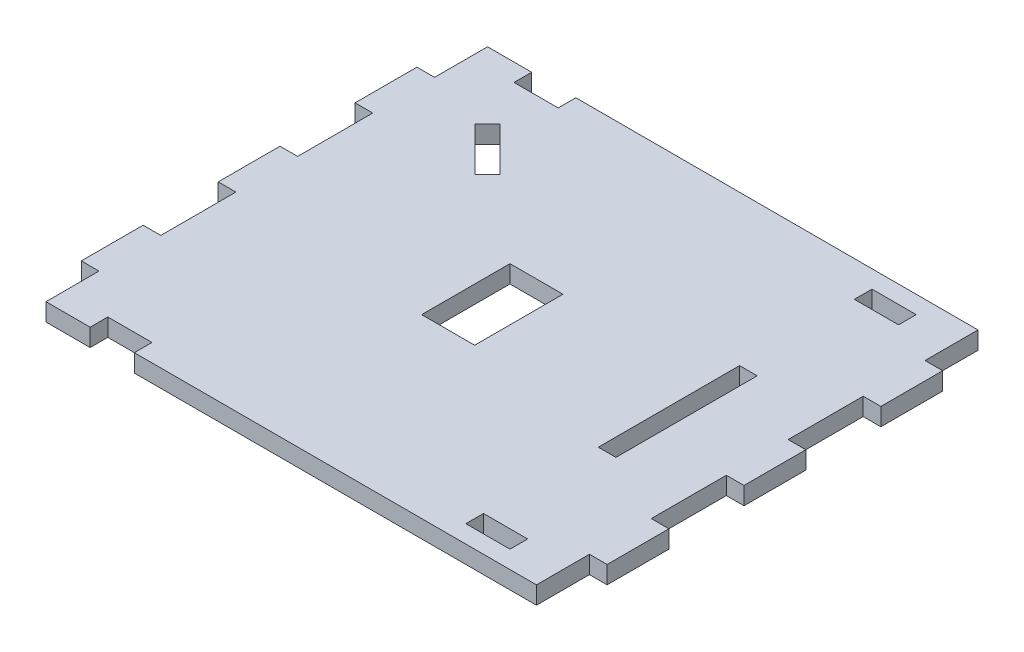
from build123d import *

# Parameters (mm, degrees)
SKETCH1_W           = 55.54
SKETCH1_H           = 50
SKETCH1_W_2         = 2
SKETCH1_H_2         = 16
SKETCH1_H_3         = 7
BOSS_EXTRUDE1_DEPTH = 2
SKETCH3_W           = 5
SKETCH3_H           = 2
CUT_EXTRUDE1_DEPTH  = 2
SKETCH4_W           = 6
SKETCH4_H           = 10
CUT_EXTRUDE2_DEPTH  = 2
CUT_EXTRUDE3_DEPTH  = 2


with BuildPart() as part:
    # Sketch1 → Boss-Extrude1 (new body)
    # profile 1 of 7: a face of its own
    with BuildSketch(Plane(origin=(0, 0, 0), x_dir=(1, 0, 0), z_dir=(0, 1, 0))):
        Rectangle(SKETCH1_W, SKETCH1_H)
        with Locations((18.77, 0)):
            Rectangle(SKETCH1_W_2, SKETCH1_H_2, mode=Mode.SUBTRACT)
    # profile 2 of 7: a face of its own
    with BuildSketch(Plane(origin=(0, 0, 0), x_dir=(1, 0, 0), z_dir=(0, 1, 0))):
        with Locations((28.77, 0)):
            Rectangle(SKETCH1_W_2, SKETCH1_H_3)
    # profile 3 of 7: a face of its own
    with BuildSketch(Plane(origin=(0, 0, 0), x_dir=(1, 0, 0), z_dir=(0, 1, 0))):
        with Locations((28.77, 15.5)):
            Rectangle(SKETCH1_W_2, SKETCH1_H_3)
    # profile 4 of 7: a face of its own
    with BuildSketch(Plane(origin=(0, 0, 0), x_dir=(1, 0, 0), z_dir=(0, 1, 0))):
        with Locations((28.77, -15.5)):
            Rectangle(SKETCH1_W_2, SKETCH1_H_3)
    # profile 5 of 7: a face of its own
    with BuildSketch(Plane(origin=(0, 0, 0), x_dir=(1, 0, 0), z_dir=(0, 1, 0))):
        with Locations((-28.77, 0)):
            Rectangle(SKETCH1_W_2, SKETCH1_H_3)
    # profile 6 of 7: a face of its own
    with BuildSketch(Plane(origin=(0, 0, 0), x_dir=(1, 0, 0), z_dir=(0, 1, 0))):
        with Locations((-28.77, -15.5)):
            Rectangle(SKETCH1_W_2, SKETCH1_H_3)
    # profile 7 of 7: a face of its own
    with BuildSketch(Plane(origin=(0, 0, 0), x_dir=(1, 0, 0), z_dir=(0, 1, 0))):
        with Locations((-28.77, 15.5)):
            Rectangle(SKETCH1_W_2, SKETCH1_H_3)
    extrude(amount=BOSS_EXTRUDE1_DEPTH)

    # Sketch3 → Cut-Extrude1 (cut)
    with BuildSketch(Plane(origin=(0, 2, 0), x_dir=(1, 0, 0), z_dir=(0, 1, 0))):
        with Locations((20.27, -22)):
            Rectangle(SKETCH3_W, SKETCH3_H)
        with Locations((20.27, 22)):
            Rectangle(SKETCH3_W, SKETCH3_H)
        with Locations((-20.27, 24)):
            Rectangle(SKETCH3_W, SKETCH3_H)
        with Locations((-20.27, -24)):
            Rectangle(SKETCH3_W, SKETCH3_H)
    extrude(amount=-CUT_EXTRUDE1_DEPTH, mode=Mode.SUBTRACT)

    # Sketch4 → Cut-Extrude2 (cut)
    with BuildSketch(Plane(origin=(0, 2, 0), x_dir=(1, 0, 0), z_dir=(0, 1, 0))):
        with Locations((-2.23, 0)):
            Rectangle(SKETCH4_W, SKETCH4_H)
    extrude(amount=-CUT_EXTRUDE2_DEPTH, mode=Mode.SUBTRACT)

    # Sketch5 → Cut-Extrude3 (cut)
    with BuildSketch(Plane(origin=(0, 2, 0), x_dir=(1, 0, 0), z_dir=(0, 1, 0))):
        Polygon((-19.496864222, 18.141064222), (-14.547116754, 13.191316754), (-15.961330317, 11.777103192), (-20.911077785, 16.72685066), align=None)
    extrude(amount=-CUT_EXTRUDE3_DEPTH, mode=Mode.SUBTRACT)


solid = part.part
